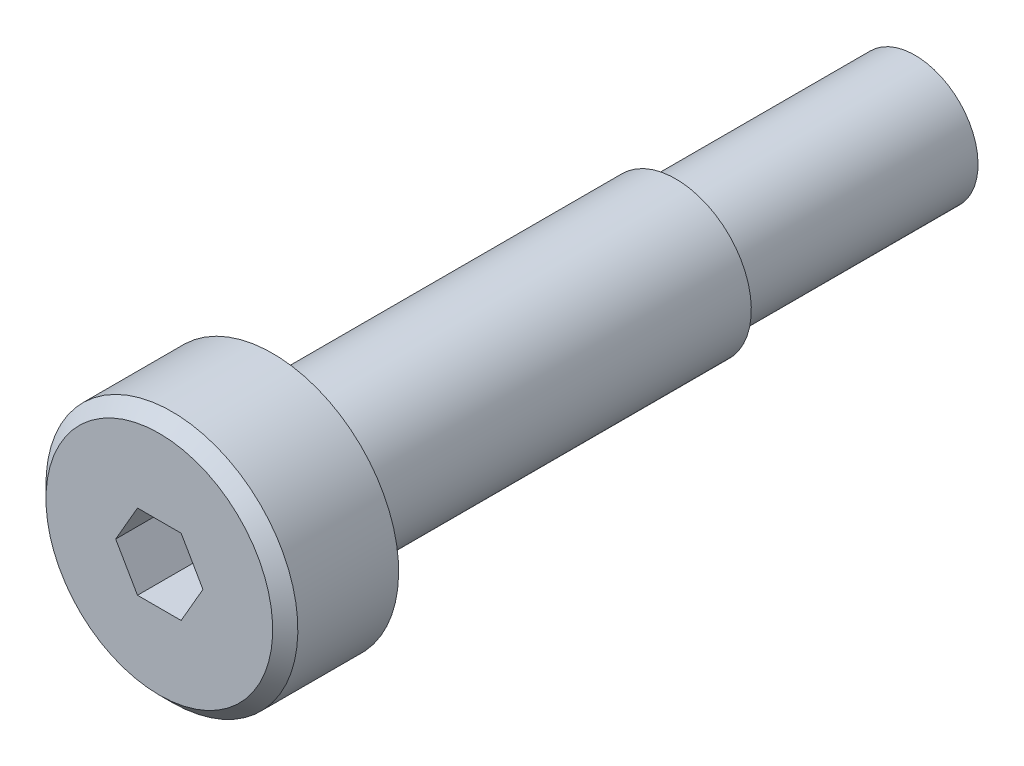
from build123d import *

# Parameters (mm, degrees)
CUT_EXTRUDE1_DEPTH = 2.7


with BuildPart() as part:
    # Sketch1 → Revolve1 (revolve)
    with BuildSketch(Plane(origin=(0, 0, 0), x_dir=(0, 0, -1), z_dir=(1, 0, 0))):
        Polygon((-16, 3), (-16, 5), (-20, 5), (-20.5, 4.5), (-20.5, 0), (9.5, 0), (9.5, 2.5), (0, 2.5), (0, 3), align=None)
    revolve(axis=Axis((0, 0, 5.584882278), (0, 0, -1)))

    # Sketch2 → Cut-Extrude1 (cut)
    with BuildSketch(Plane.XY.offset(20.5)):
        Polygon((0.866025404, -1.5), (1.732050808, 0), (0.866025404, 1.5), (-0.866025404, 1.5), (-1.732050808, 0), (-0.866025404, -1.5), align=None)
    extrude(amount=-CUT_EXTRUDE1_DEPTH, mode=Mode.SUBTRACT)


solid = part.part
